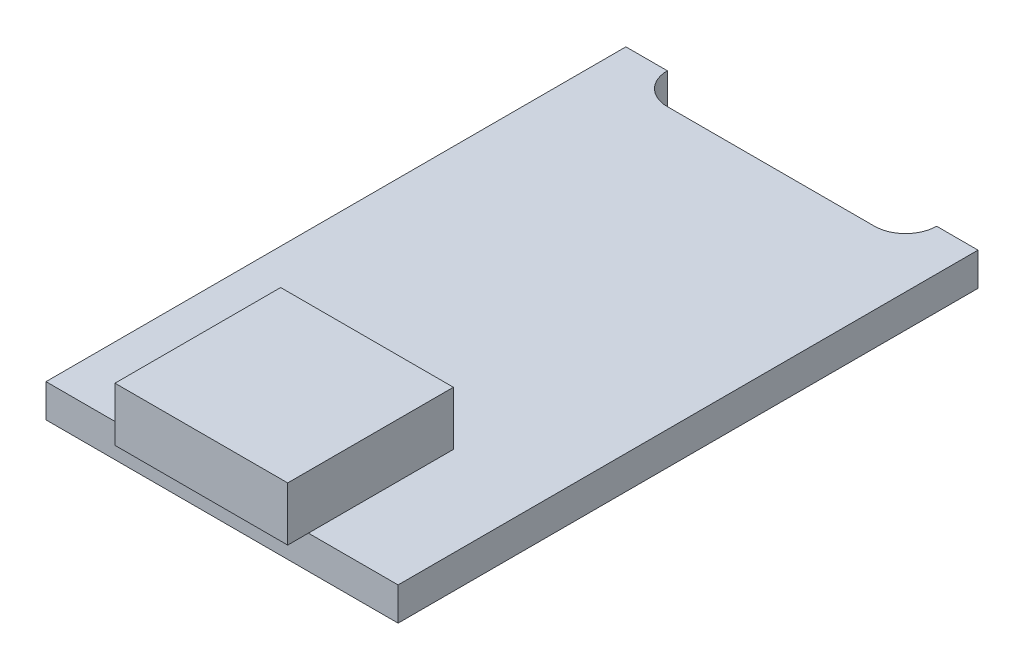
from build123d import *

# Parameters (mm, degrees)
SKETCH1_W           = 17
SKETCH1_H           = 28
BOSS_EXTRUDE1_DEPTH = 1.6
SKETCH2_W           = 8.34
SKETCH2_H           = 8
BOSS_EXTRUDE2_DEPTH = 2.6
CUT_EXTRUDE1_DEPTH  = 18.435882541


with BuildPart() as part:
    # Sketch1 → Boss-Extrude1 (new body)
    with BuildSketch(Plane(origin=(0, 0, 0), x_dir=(1, 0, 0), z_dir=(0, 1, 0))):
        Rectangle(SKETCH1_W, SKETCH1_H)
    extrude(amount=BOSS_EXTRUDE1_DEPTH)

    # Sketch2 → Boss-Extrude2 (add)
    with BuildSketch(Plane(origin=(0, 1.6, 0), x_dir=(1, 0, 0), z_dir=(0, 1, 0))):
        with Locations((0, -11)):
            Rectangle(SKETCH2_W, SKETCH2_H)
    extrude(amount=BOSS_EXTRUDE2_DEPTH)

    # Sketch3 → Cut-Extrude1 (cut, through all)
    with BuildSketch(Plane(origin=(0, 1.6, 0), x_dir=(1, 0, 0), z_dir=(0, 1, 0))):
        with BuildLine():
            Line((-5, 15.5), (5, 15.5))
            ThreePointArc((5, 15.5), (6.5, 14), (5, 12.5))
            Line((5, 12.5), (-5, 12.5))
            ThreePointArc((-5, 12.5), (-6.5, 14), (-5, 15.5))
        make_face()
    extrude(amount=-CUT_EXTRUDE1_DEPTH, mode=Mode.SUBTRACT)


solid = part.part
